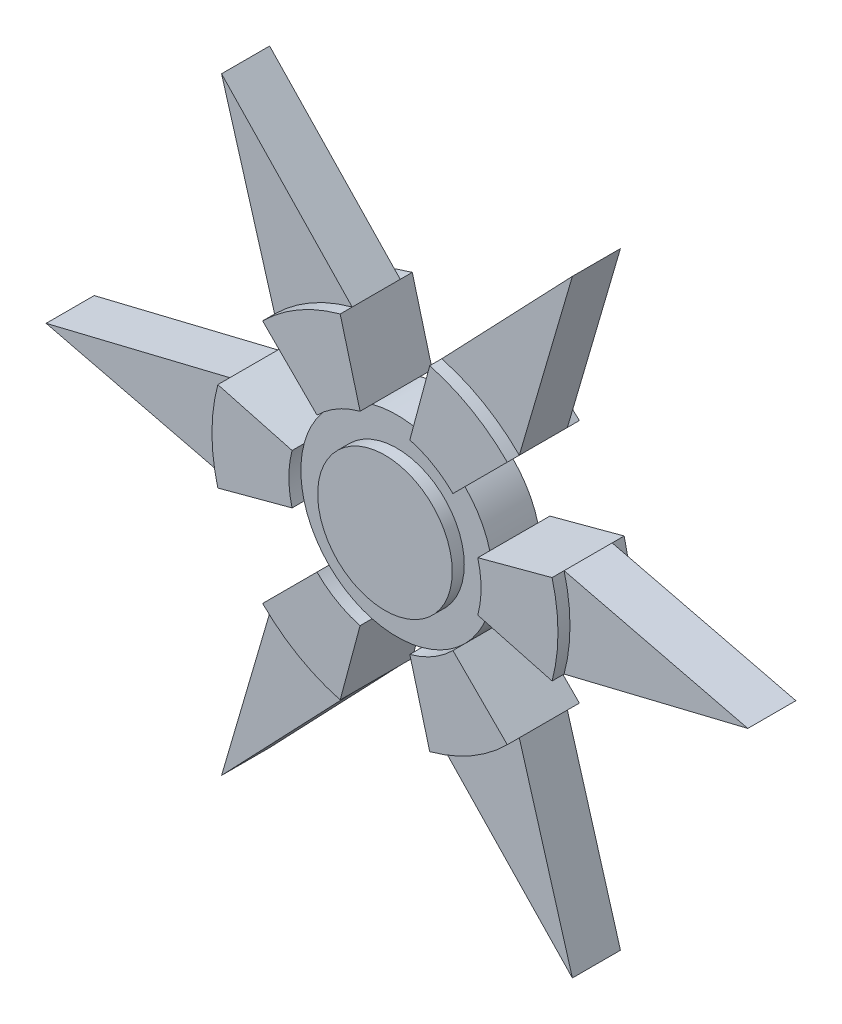
from build123d import *

# Parameters (mm, degrees)
BOSS_EXTRUDE1_DEPTH   = 7.5
BOSS_EXTRUDE1_2_DEPTH = 7.5
BOSS_EXTRUDE1_3_DEPTH = 7.5
BOSS_EXTRUDE1_4_DEPTH = 7.5
BOSS_EXTRUDE1_5_DEPTH = 7.5
BOSS_EXTRUDE1_6_DEPTH = 7.5
SKETCH1_R             = 14
BOSS_EXTRUDE1_7_DEPTH = 7.5
SKETCH1_6_R           = 20
SKETCH1_6_R_2         = 14
BOSS_EXTRUDE3_DEPTH   = 5


with BuildPart() as part:
    # Sketch1 → Boss-Extrude1 (new, symmetric)
    with BuildSketch(Plane.XY):
        with BuildLine():
            ThreePointArc((34.773329746, -9.317485624), (36, 0), (34.773329746, 9.317485624))
            Line((34.773329746, 9.317485624), (19.318516526, 5.176380902))
            ThreePointArc((19.318516526, 5.176380902), (20, 0), (19.318516526, -5.176380902))
            Line((19.318516526, -5.176380902), (34.773329746, -9.317485624))
        make_face()
    extrude(amount=BOSS_EXTRUDE1_DEPTH, both=True)



with BuildPart() as body_2:
    # Sketch1 → Boss-Extrude1 2 (new, symmetric)
    with BuildSketch(Plane.XY):
        with BuildLine():
            ThreePointArc((5.176380902, 19.318516526), (10, 17.320508076), (14.142135624, 14.142135624))
            Line((14.142135624, 14.142135624), (25.455844123, 25.455844123))
            ThreePointArc((25.455844123, 25.455844123), (18, 31.176914536), (9.317485624, 34.773329746))
            Line((9.317485624, 34.773329746), (5.176380902, 19.318516526))
        make_face()
    extrude(amount=BOSS_EXTRUDE1_2_DEPTH, both=True)


with BuildPart() as body_3:
    # Sketch1 → Boss-Extrude1 3 (new, symmetric)
    with BuildSketch(Plane.XY):
        with BuildLine():
            Line((25.455844123, -25.455844123), (14.142135624, -14.142135624))
            ThreePointArc((14.142135624, -14.142135624), (10, -17.320508076), (5.176380902, -19.318516526))
            Line((5.176380902, -19.318516526), (9.317485624, -34.773329746))
            ThreePointArc((9.317485624, -34.773329746), (18, -31.176914536), (25.455844123, -25.455844123))
        make_face()
    extrude(amount=BOSS_EXTRUDE1_3_DEPTH, both=True)


with BuildPart() as body_4:
    # Sketch1 → Boss-Extrude1 4 (new, symmetric)
    with BuildSketch(Plane.XY):
        with BuildLine():
            ThreePointArc((-14.142135624, 14.142135624), (-10, 17.320508076), (-5.176380902, 19.318516526))
            Line((-5.176380902, 19.318516526), (-9.317485624, 34.773329746))
            ThreePointArc((-9.317485624, 34.773329746), (-18, 31.176914536), (-25.455844123, 25.455844123))
            Line((-25.455844123, 25.455844123), (-14.142135624, 14.142135624))
        make_face()
    extrude(amount=BOSS_EXTRUDE1_4_DEPTH, both=True)


with BuildPart() as body_5:
    # Sketch1 → Boss-Extrude1 5 (new, symmetric)
    with BuildSketch(Plane.XY):
        with BuildLine():
            Line((-9.317485624, -34.773329746), (-5.176380902, -19.318516526))
            ThreePointArc((-5.176380902, -19.318516526), (-10, -17.320508076), (-14.142135624, -14.142135624))
            Line((-14.142135624, -14.142135624), (-25.455844123, -25.455844123))
            ThreePointArc((-25.455844123, -25.455844123), (-18, -31.176914536), (-9.317485624, -34.773329746))
        make_face()
    extrude(amount=BOSS_EXTRUDE1_5_DEPTH, both=True)


with BuildPart() as body_6:
    # Sketch1 → Boss-Extrude1 6 (new, symmetric)
    with BuildSketch(Plane.XY):
        with BuildLine():
            ThreePointArc((-19.318516526, -5.176380902), (-20, 0), (-19.318516526, 5.176380902))
            Line((-19.318516526, 5.176380902), (-34.773329746, 9.317485624))
            ThreePointArc((-34.773329746, 9.317485624), (-36, 0), (-34.773329746, -9.317485624))
            Line((-34.773329746, -9.317485624), (-19.318516526, -5.176380902))
        make_face()
    extrude(amount=BOSS_EXTRUDE1_6_DEPTH, both=True)


with BuildPart() as body_7:
    # Sketch1 → Boss-Extrude1 7 (new, symmetric)
    with BuildSketch(Plane.XY):
        Circle(SKETCH1_R)
    extrude(amount=BOSS_EXTRUDE1_7_DEPTH, both=True)


with BuildPart() as part_1:
    add(part.part)

    add(body_2.part)  # Boss-Extrude3 merges body 2

    add(body_3.part)  # Boss-Extrude3 merges body 3

    add(body_4.part)  # Boss-Extrude3 merges body 4

    add(body_5.part)  # Boss-Extrude3 merges body 5

    add(body_6.part)  # Boss-Extrude3 merges body 6

    add(body_7.part)  # Boss-Extrude3 merges body 7
    # Sketch1<6> → Boss-Extrude3 (add, symmetric)
    # profile 1 of 7: a face of its own
    with BuildSketch(Plane.XY):
        with BuildLine():
            Line((73, 0), (34.773329746, 9.317485624))
            ThreePointArc((34.773329746, 9.317485624), (36, 0), (34.773329746, -9.317485624))
            Line((34.773329746, -9.317485624), (73, 0))
        make_face()
    # profile 2 of 7: a face of its own
    with BuildSketch(Plane.XY):
        Circle(SKETCH1_6_R)
        Circle(SKETCH1_6_R_2, mode=Mode.SUBTRACT)
    # profile 3 of 7: a face of its own
    with BuildSketch(Plane.XY):
        with BuildLine():
            ThreePointArc((9.317485624, 34.773329746), (18, 31.176914536), (25.455844123, 25.455844123))
            Line((25.455844123, 25.455844123), (36.5, 63.219854476))
            Line((36.5, 63.219854476), (9.317485624, 34.773329746))
        make_face()
    # profile 4 of 7: a face of its own
    with BuildSketch(Plane.XY):
        with BuildLine():
            Line((36.5, -63.219854476), (25.455844123, -25.455844123))
            ThreePointArc((25.455844123, -25.455844123), (18, -31.176914536), (9.317485624, -34.773329746))
            Line((9.317485624, -34.773329746), (36.5, -63.219854476))
        make_face()
    # profile 5 of 7: a face of its own
    with BuildSketch(Plane.XY):
        with BuildLine():
            ThreePointArc((-25.455844123, 25.455844123), (-18, 31.176914536), (-9.317485624, 34.773329746))
            Line((-9.317485624, 34.773329746), (-36.5, 63.219854476))
            Line((-36.5, 63.219854476), (-25.455844123, 25.455844123))
        make_face()
    # profile 6 of 7: a face of its own
    with BuildSketch(Plane.XY):
        with BuildLine():
            Line((-36.5, -63.219854476), (-9.317485624, -34.773329746))
            ThreePointArc((-9.317485624, -34.773329746), (-18, -31.176914536), (-25.455844123, -25.455844123))
            Line((-25.455844123, -25.455844123), (-36.5, -63.219854476))
        make_face()
    # profile 7 of 7: a face of its own
    with BuildSketch(Plane.XY):
        with BuildLine():
            ThreePointArc((-34.773329746, -9.317485624), (-36, 0), (-34.773329746, 9.317485624))
            Line((-34.773329746, 9.317485624), (-73, 0))
            Line((-73, 0), (-34.773329746, -9.317485624))
        make_face()
    extrude(amount=BOSS_EXTRUDE3_DEPTH, both=True)


solid = part_1.part
